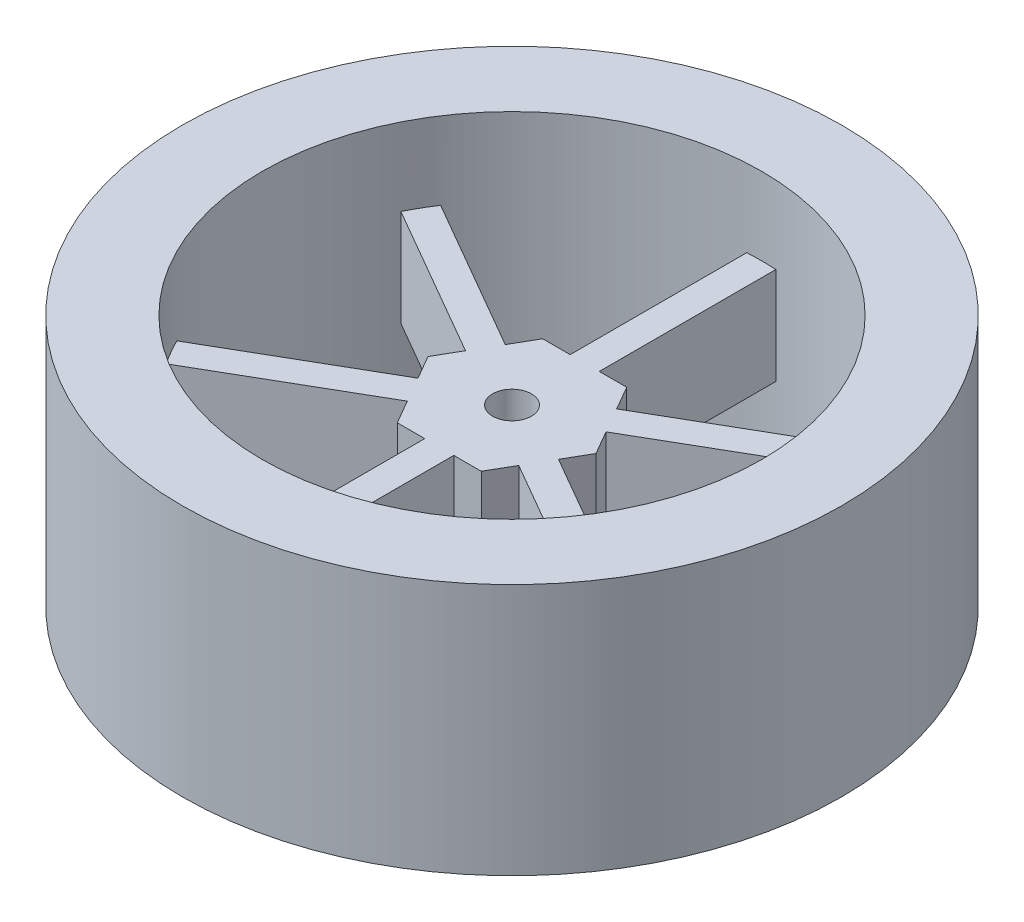
from build123d import *

# Parameters (mm, degrees)
SKETCH_1_R      = 34
SKETCH_1_R_2    = 25.75
EXTRUDE_1_DEPTH = 26
EXTRUDE_2_DEPTH = 5
SKETCH_2_4_R    = 2
EXTRUDE_3_DEPTH = 5


with BuildPart() as part:
    # 草图1 → 凸台-拉伸1 (new body)
    with BuildSketch(Plane(origin=(0, 0, 0), x_dir=(1, 0, 0), z_dir=(0, 1, 0))):
        Circle(SKETCH_1_R)
        Circle(SKETCH_1_R_2, mode=Mode.SUBTRACT)
    extrude(amount=EXTRUDE_1_DEPTH)

    # 草图2 → 凸台-拉伸2 (add, symmetric)
    with BuildSketch(Plane(origin=(0, 13, 0), x_dir=(1, 0, 0), z_dir=(0, 1, 0))):
        with BuildLine():
            Line((7.245190528, -2.450961894), (8.660254038, 0))
            Line((8.660254038, 0), (7.245190528, 2.450961894))
            Line((7.245190528, 2.450961894), (23.012285934, 11.554098671))
            ThreePointArc((23.012285934, 11.554098671), (22.300154147, 12.875), (21.512285934, 14.152174882))
            Line((21.512285934, 14.152174882), (5.745190528, 5.049038106))
            Line((5.745190528, 5.049038106), (4.330127019, 7.5))
            Line((4.330127019, 7.5), (1.5, 7.5))
            Line((1.5, 7.5), (1.5, 25.706273553))
            ThreePointArc((1.5, 25.706273553), (0, 25.75), (-1.5, 25.706273553))
            Line((-1.5, 25.706273553), (-1.5, 7.5))
            Line((-1.5, 7.5), (-4.330127019, 7.5))
            Line((-4.330127019, 7.5), (-5.745190528, 5.049038106))
            Line((-5.745190528, 5.049038106), (-21.512285934, 14.152174882))
            ThreePointArc((-21.512285934, 14.152174882), (-22.300154147, 12.875), (-23.012285934, 11.554098671))
            Line((-23.012285934, 11.554098671), (-7.245190528, 2.450961894))
            Line((-7.245190528, 2.450961894), (-8.660254038, 0))
            Line((-8.660254038, 0), (-7.245190528, -2.450961894))
            Line((-7.245190528, -2.450961894), (-23.012285934, -11.554098671))
            ThreePointArc((-23.012285934, -11.554098671), (-22.300154147, -12.875), (-21.512285934, -14.152174882))
            Line((-21.512285934, -14.152174882), (-5.745190528, -5.049038106))
            Line((-5.745190528, -5.049038106), (-4.330127019, -7.5))
            Line((-4.330127019, -7.5), (-1.5, -7.5))
            Line((-1.5, -7.5), (-1.5, -25.706273553))
            ThreePointArc((-1.5, -25.706273553), (0, -25.75), (1.5, -25.706273553))
            Line((1.5, -25.706273553), (1.5, -7.5))
            Line((1.5, -7.5), (4.330127019, -7.5))
            Line((4.330127019, -7.5), (5.745190528, -5.049038106))
            Line((5.745190528, -5.049038106), (21.512285934, -14.152174882))
            ThreePointArc((21.512285934, -14.152174882), (22.300154147, -12.875), (23.012285934, -11.554098671))
            Line((23.012285934, -11.554098671), (7.245190528, -2.450961894))
        make_face()
        Polygon((3.464101615, 6), (6.92820323, 0), (3.464101615, -6), (-3.464101615, -6), (-6.92820323, 0), (-3.464101615, 6), align=None, mode=Mode.SUBTRACT)
    extrude(amount=EXTRUDE_2_DEPTH, both=True)

    # 草图2<4> → 凸台-拉伸3 (add)
    with BuildSketch(Plane(origin=(0, 13, 0), x_dir=(1, 0, 0), z_dir=(0, 1, 0))):
        Polygon((3.464101615, -6), (6.92820323, 0), (3.464101615, 6), (-3.464101615, 6), (-6.92820323, 0), (-3.464101615, -6), align=None)
        Circle(SKETCH_2_4_R, mode=Mode.SUBTRACT)
    extrude(amount=EXTRUDE_3_DEPTH)


solid = part.part
